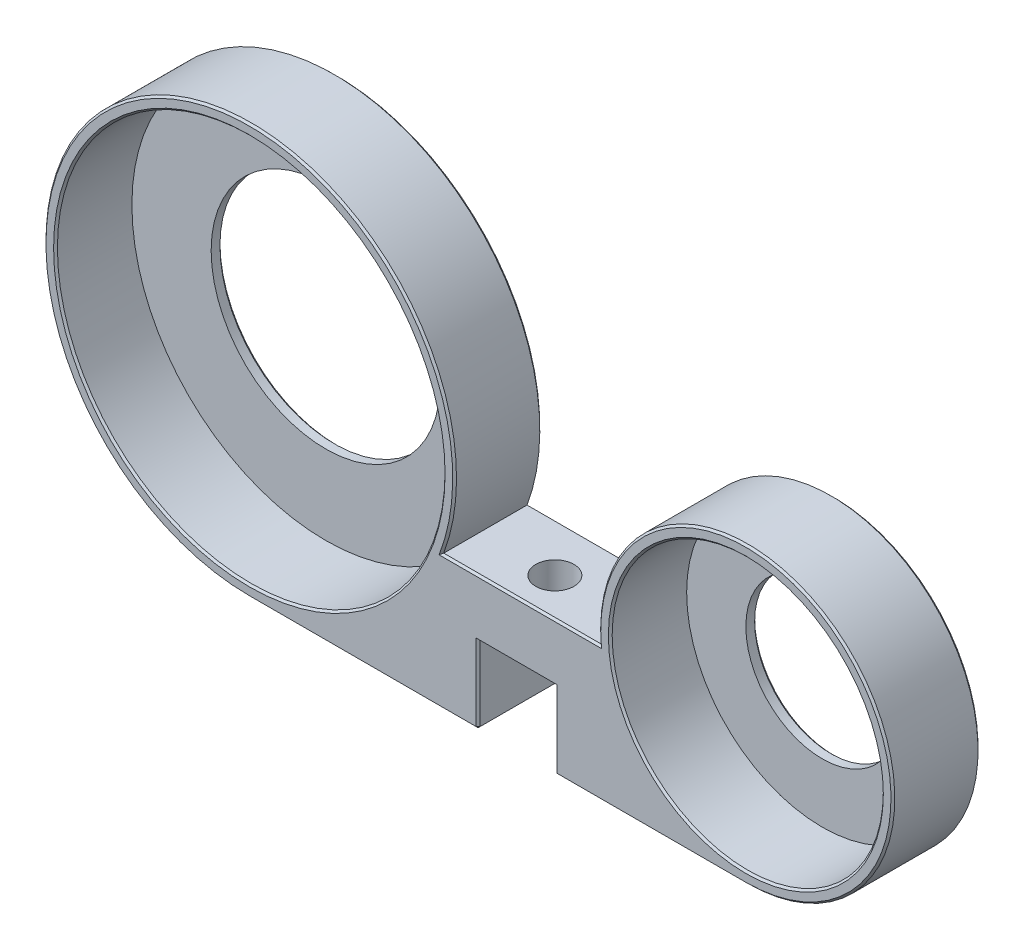
from build123d import *

# Parameters (mm, degrees)
SKETCH2_R           = 50.75
SKETCH2_R_2         = 35.5
BOSS_EXTRUDE1_DEPTH = 20
SKETCH3_R           = 2.75
CUT_EXTRUDE1_DEPTH  = 251.172565442
SKETCH4_R           = 5
CUT_EXTRUDE2_DEPTH  = 10
BOSS_EXTRUDE2_START = 3
SKETCH5_R           = 20
SKETCH5_R_2         = 30
BOSS_EXTRUDE2_DEPTH = 3
CHAMFER1_SIZE       = 0.7
CHAMFER2_SIZE       = 0.5


with BuildPart() as part:
    # Sketch2 → Boss-Extrude1 (new body)
    with BuildSketch(Plane.XY):
        with BuildLine():
            Line((-10.1, 109), (-10.1, 129.1))
            Line((-10.1, 129.1), (10.1, 129.1))
            Line((10.1, 129.1), (10.1, 109))
            Line((10.1, 109), (60, 109))
            ThreePointArc((60, 109), (85.993749249, 175.900264083), (21.650423731, 144.1))
            Line((21.650423731, 144.1), (-19.589286853, 144.1))
            ThreePointArc((-19.589286853, 144.1), (-100.713392844, 206.860656309), (-70, 109))
            Line((-70, 109), (-10.1, 109))
        make_face()
        with Locations((-70, 162.75)):
            Circle(SKETCH2_R, mode=Mode.SUBTRACT)
        with Locations((60, 147.5)):
            Circle(SKETCH2_R_2, mode=Mode.SUBTRACT)
    extrude(amount=BOSS_EXTRUDE1_DEPTH)

    # Sketch3 → Cut-Extrude1 (cut, through all)
    with BuildSketch(Plane(origin=(0, 0, 0), x_dir=(1, 0, 0), z_dir=(0, 1, 0))):
        with Locations(Location((0, -10, 0), (0, 0, 90))):
            Circle(SKETCH3_R)
    extrude(amount=CUT_EXTRUDE1_DEPTH, mode=Mode.SUBTRACT)

    # Sketch4 → Cut-Extrude2 (cut)
    with BuildSketch(Plane(origin=(0, 144.1, 0), x_dir=(1, 0, 0), z_dir=(0, 1, 0))):
        with Locations(Location((0, -10, 0), (0, 0, 270))):
            Circle(SKETCH4_R)
    extrude(amount=-CUT_EXTRUDE2_DEPTH, mode=Mode.SUBTRACT)

    # Sketch5 → Boss-Extrude2 (add)
    with BuildSketch(Plane(origin=(0, 0, 0), x_dir=(-1, 0, 0), z_dir=(0, 0, -1)).offset(BOSS_EXTRUDE2_START)):
        with BuildLine():
            Line((10.1, 109), (70, 109))
            ThreePointArc((70, 109), (100.713392844, 206.860656309), (19.589286853, 144.1))
            Line((19.589286853, 144.1), (-21.650423731, 144.1))
            ThreePointArc((-21.650423731, 144.1), (-85.993749249, 175.900264083), (-60, 109))
            Line((-60, 109), (-10.1, 109))
            Line((-10.1, 109), (-10.1, 129.1))
            Line((-10.1, 129.1), (10.1, 129.1))
            Line((10.1, 129.1), (10.1, 109))
        make_face()
        with Locations((-60, 147.5)):
            Circle(SKETCH5_R, mode=Mode.SUBTRACT)
        with Locations((70, 162.75)):
            Circle(SKETCH5_R_2, mode=Mode.SUBTRACT)
    extrude(amount=-BOSS_EXTRUDE2_DEPTH)

    # Chamfer1
    chamfer1_edges = [part.edges().sort_by_distance(p)[0] for p in [
        (-10.1, 119.05, -3),
        (-40.05, 109, -3),
        (-100.713392844, 206.860656309, -3),
        (1.030568439, 144.1, -3),
        (85.993749249, 175.900264083, -3),
        (35.05, 109, -3),
        (10.1, 119.05, -3),
        (0, 129.1, -3),
        (80, 147.5, -3),
        (-40, 162.75, -3),
    ]]
    chamfer(chamfer1_edges, length=CHAMFER1_SIZE)

    # Chamfer2
    chamfer2_edges = [part.edges().sort_by_distance(p)[0] for p in [
        (0, 129.1, 20),
        (10.1, 109, 10),
        (-10.1, 109, 8.85),
        (10.1, 119.05, 20),
        (35.05, 109, 20),
        (-120.75, 162.75, 20),
        (85.993749249, 175.900264083, 20),
        (24.5, 147.5, 20),
        (1.030568439, 144.1, 20),
        (-100.713392844, 206.860656309, 20),
        (-40.05, 109, 20),
        (-10.1, 119.05, 20),
    ]]
    chamfer(chamfer2_edges, length=CHAMFER2_SIZE)


solid = part.part
